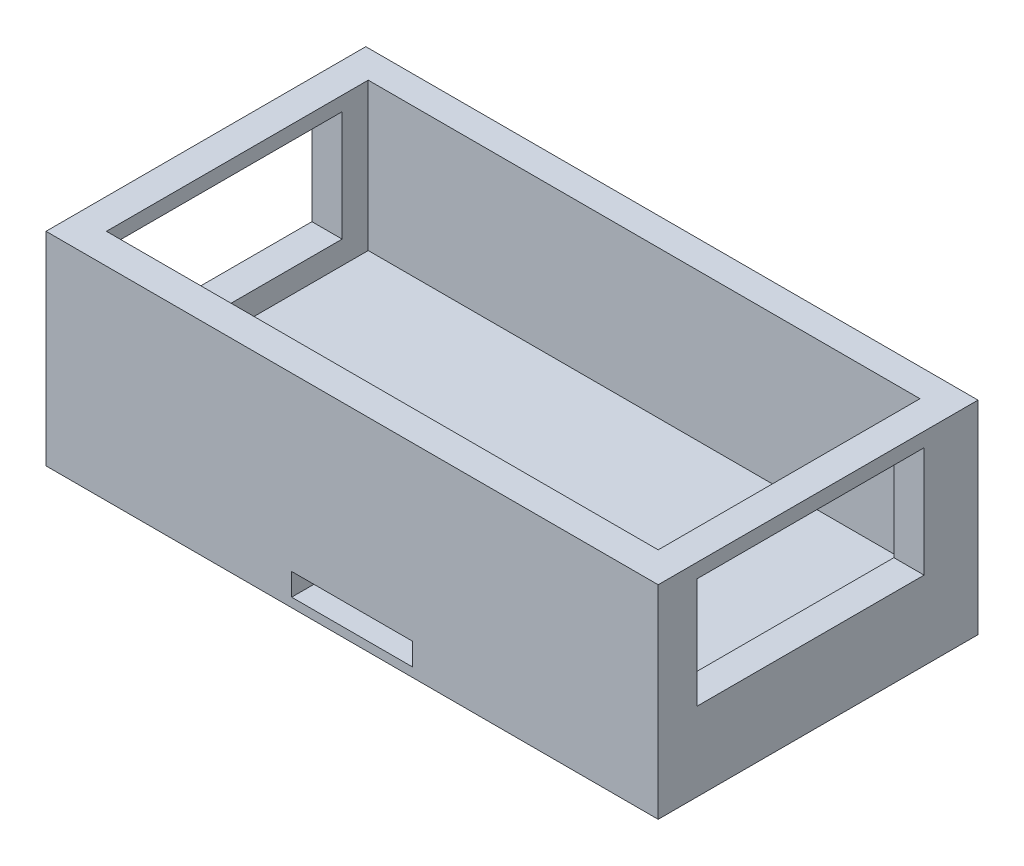
from build123d import *

# Parameters (mm, degrees)
SKETCH1_W           = 128.651
SKETCH1_H           = 67.2084
BOSS_EXTRUDE1_DEPTH = 42.6974
SKETCH2_W           = 115.951
SKETCH2_H           = 55.0164
CUT_EXTRUDE1_DEPTH  = 31.0134
SKETCH3_W           = 25.4
SKETCH3_H           = 4.684620624
CUT_EXTRUDE2_DEPTH  = 67.7164
SKETCH5_W           = 47.752
SKETCH5_H           = 23.185308257
CUT_EXTRUDE3_DEPTH  = 6.35


with BuildPart() as part:
    # Sketch1 → Boss-Extrude1 (new body)
    with BuildSketch(Plane(origin=(0, 0, 0), x_dir=(1, 0, 0), z_dir=(0, 1, 0))):
        with Locations((64.3255, 33.6042)):
            Rectangle(SKETCH1_W, SKETCH1_H)
    extrude(amount=BOSS_EXTRUDE1_DEPTH)

    # Sketch2 → Cut-Extrude1 (cut)
    with BuildSketch(Plane(origin=(0, 42.6974, 0), x_dir=(1, 0, 0), z_dir=(0, 1, 0))):
        with Locations((64.3255, 33.8582)):
            Rectangle(SKETCH2_W, SKETCH2_H)
    extrude(amount=-CUT_EXTRUDE1_DEPTH, mode=Mode.SUBTRACT)

    # Sketch3 → Cut-Extrude2 (cut)
    with BuildSketch(Plane.XY):
        with Locations((64.3255, 4.261689688)):
            Rectangle(SKETCH3_W, SKETCH3_H)
    extrude(amount=-CUT_EXTRUDE2_DEPTH, mode=Mode.SUBTRACT)

    # Sketch5 → Cut-Extrude3 (cut)
    with BuildSketch(Plane(origin=(128.651, 0, 0), x_dir=(0, 0, -1), z_dir=(1, 0, 0))):
        with Locations((32.004, 28.102654128)):
            Rectangle(SKETCH5_W, SKETCH5_H)
    cut_extrude3 = extrude(amount=-CUT_EXTRUDE3_DEPTH, mode=Mode.SUBTRACT)

    # Mirror1: Cut-Extrude3 across plane
    add(cut_extrude3.mirror(Plane.ZY.offset(-64.3255)), mode=Mode.SUBTRACT)


solid = part.part
